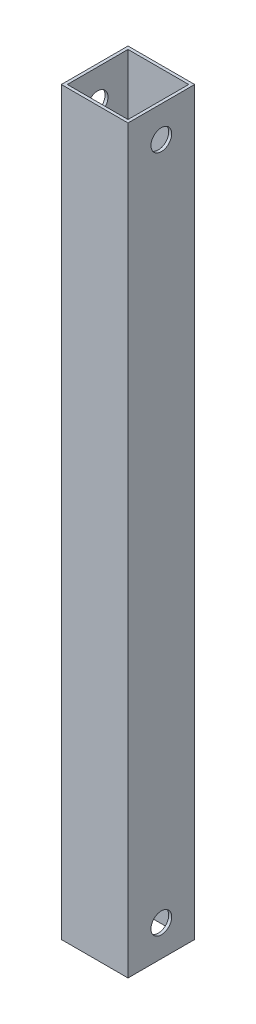
from build123d import *

# Parameters (mm, degrees)
CROQUIS1_W              = 45
CROQUIS1_H              = 45
SALIENTE_EXTRUIR1_DEPTH = 500
CROQUIS2_W              = 41
CROQUIS2_H              = 41
CORTAR_EXTRUIR1_DEPTH   = 505.03372903
CROQUIS3_R              = 7
CORTAR_EXTRUIR2_DEPTH   = 505.03372903


with BuildPart() as part:
    # Croquis1 → Saliente-Extruir1 (new body)
    with BuildSketch(Plane(origin=(0, 0, 0), x_dir=(1, 0, 0), z_dir=(0, 1, 0))):
        with Locations((22.5, 22.5)):
            Rectangle(CROQUIS1_W, CROQUIS1_H)
    extrude(amount=SALIENTE_EXTRUIR1_DEPTH)

    # Croquis2 → Cortar-Extruir1 (cut, through all)
    with BuildSketch(Plane(origin=(0, 500, 0), x_dir=(1, 0, 0), z_dir=(0, 1, 0))):
        with Locations((22.5, 22.5)):
            Rectangle(CROQUIS2_W, CROQUIS2_H)
    extrude(amount=-CORTAR_EXTRUIR1_DEPTH, mode=Mode.SUBTRACT)

    # Croquis3 → Cortar-Extruir2 (cut, through all)
    with BuildSketch(Plane(origin=(45, 0, 0), x_dir=(0, 0, -1), z_dir=(1, 0, 0))):
        with Locations((22.5, 479)):
            Circle(CROQUIS3_R)
        with Locations((22.5, 21)):
            Circle(CROQUIS3_R)
    extrude(amount=-CORTAR_EXTRUIR2_DEPTH, mode=Mode.SUBTRACT)


solid = part.part
